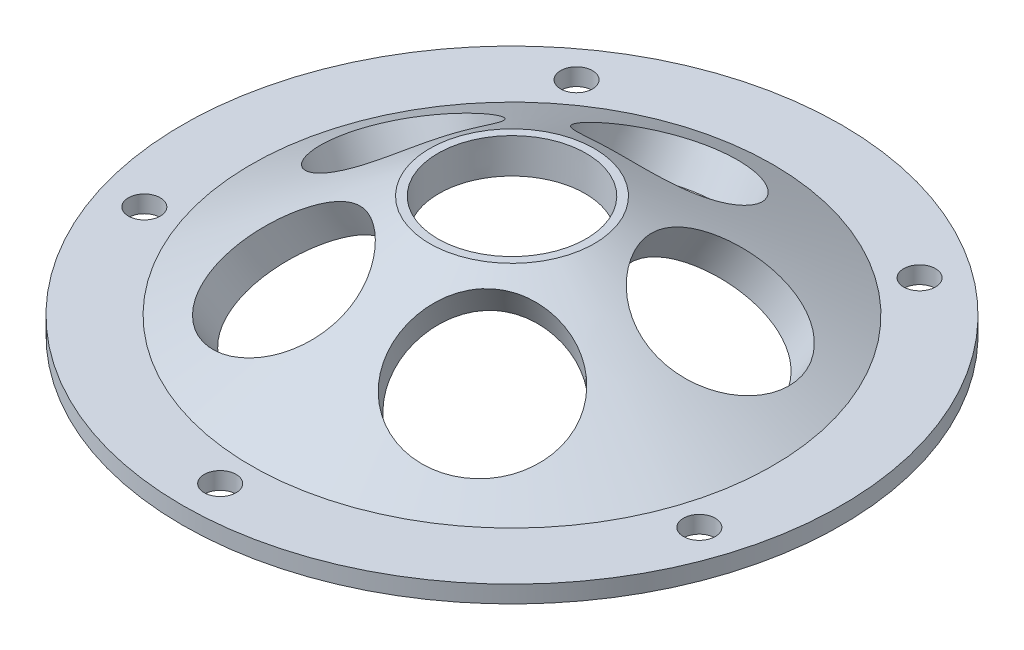
from build123d import *

# Parameters (mm, degrees)
F_7_16_0_4375_DIAMETER_HOLE1_D     = 11.1125
F_7_16_0_4375_DIAMETER_HOLE2_D     = 11.1125
F_7_16_0_4375_DIAMETER_HOLE2_DEPTH = 32.512
F_7_16_0_4375_DIAMETER_HOLE2_TIP   = 3.338531814
CIRPATTERN2_COUNT                  = 5
CIRPATTERN3_COUNT                  = 5
CIRPATTERN4_COUNT                  = 5


with BuildPart() as part:
    # Sketch1 → Revolve1 (revolve)
    with BuildSketch(Plane.XY, mode=Mode.PRIVATE) as revolve1_sk:
        Polygon((-7.62, 3.175), (0, 3.175), (0, 0), (-6.769261314, 0), (-20.529630657, -7.944552944), (-30.48, -7.944552944), (-30.48, -6.357052944), (-24.13, -6.357052944), align=None)
    revolve(revolve1_sk.sketch.rotate(Axis((0, 0, 0), (0, 1, 0)), 270), axis=Axis((0, 0, 0), (0, 1, 0)))

    # 7/16 (0.4375) Diameter Hole1 (through all)
    with Locations(Plane(origin=(-0.406720384, -1.197217013, -15.187456994), x_dir=(0, 0.499865584957, 0.866102994438), z_dir=(-0.013385210548, 0.866025403784, -0.499820804027))):
        with Locations((0, 0)):
            f_7_16_0_4375_diameter_hole1 = Hole(F_7_16_0_4375_DIAMETER_HOLE1_D / 2)

    # 7/16 (0.4375) Diameter Hole2
    with Locations(Plane(origin=(0, 3.175, 0), x_dir=(1, 0, 0), z_dir=(0, 1, 0))):
        with Locations((0, 0)):
            Hole(F_7_16_0_4375_DIAMETER_HOLE2_D / 2, depth=F_7_16_0_4375_DIAMETER_HOLE2_DEPTH)
            with Locations((0, 0, -(F_7_16_0_4375_DIAMETER_HOLE2_DEPTH + F_7_16_0_4375_DIAMETER_HOLE2_TIP / 2))):  # 118° drill point
                Cone(0, F_7_16_0_4375_DIAMETER_HOLE2_D / 2, F_7_16_0_4375_DIAMETER_HOLE2_TIP, mode=Mode.SUBTRACT)

    # CirPattern2: 7/16 (0.4375) Diameter Hole1 ×5 about axis
    cirpattern2_axis = Axis((0, 3.175, 0), (0, -1, 0))
    for i in range(1, CIRPATTERN2_COUNT):
        add(f_7_16_0_4375_diameter_hole1.rotate(cirpattern2_axis, i * 360 / CIRPATTERN2_COUNT), mode=Mode.SUBTRACT)

    # Sketch18 → 1/4 NPT Tapped Hole4 (revolve, cut)
    with BuildSketch(Plane(origin=(0, 3.175, 0), x_dir=(0, 0, 1), z_dir=(1, 0, 0))):
        Polygon((0, 0), (0, 20.360347279), (5.5626, 17.018), (5.5626, 9.906), (6.557984794, 9.906), (6.8545837, 0), align=None)
    revolve(axis=Axis((0, 9.525, 0), (0, -1, 0)), mode=Mode.SUBTRACT)

    # Sketch19 → 1/4 NPT Tapped Hole5 (revolve, cut)
    with BuildSketch(Plane(origin=(-0.404053158, -1.197217013, -15.187528188), x_dir=(-0.7579462850314482, 0.31730303280331607, 0.569944044956033), z_dir=(0.6521814220852129, 0.38641788956234796, 0.6521814220852129))):
        Polygon((0, 0), (0, 20.360347279), (5.5626, 17.018), (5.5626, 9.906), (6.557984794, 9.906), (6.8545837, 0), align=None)
    f_1_4_npt_tapped_hole5 = revolve(axis=Axis((-0.488491851, 4.302044301, -18.361405172), (0.013297431854920659, -0.866025403784438, 0.49982314702909153)), mode=Mode.SUBTRACT)

    # CirPattern3: 1/4 NPT Tapped Hole5 ×5 about axis
    cirpattern3_axis = Axis((0, 3.175, 0), (0, -1, 0))
    for i in range(1, CIRPATTERN3_COUNT):
        add(f_1_4_npt_tapped_hole5.rotate(cirpattern3_axis, i * 360 / CIRPATTERN3_COUNT), mode=Mode.SUBTRACT)

    # Sketch20 → #4 Clearance Hole1 (revolve, cut)
    with BuildSketch(Plane(origin=(0, -6.357052944, 26.9875), x_dir=(0, 0, 1), z_dir=(1, 0, 0))):
        Polygon((0, 0), (0, 32.127187864), (1.4732, 31.242), (1.4732, 0), align=None)
    f_4_clearance_hole1 = revolve(axis=Axis((0, -0.007052944, 26.9875), (0, -1, 0)), mode=Mode.SUBTRACT)

    # CirPattern4: #4 Clearance Hole1 ×5 about axis
    cirpattern4_axis = Axis((0, 0, 0), (0, 1, 0))
    for i in range(1, CIRPATTERN4_COUNT):
        add(f_4_clearance_hole1.rotate(cirpattern4_axis, i * 360 / CIRPATTERN4_COUNT), mode=Mode.SUBTRACT)


solid = part.part
